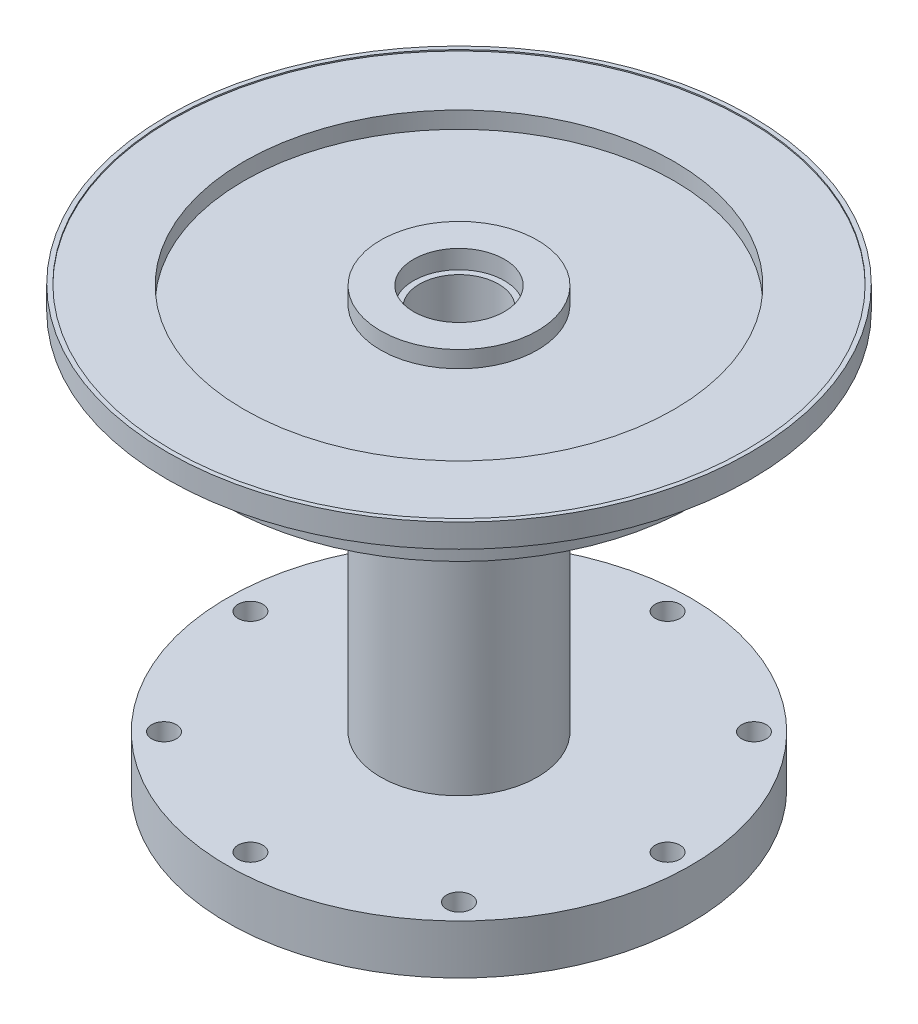
from build123d import *

# Parameters (mm, degrees)
SKETCH1_R           = 38.1
BOSS_EXTRUDE1_DEPTH = 4.826
SKETCH2_R           = 38.1
BOSS_EXTRUDE2_DEPTH = 3.302
BOSS_EXTRUDE2_DRAFT = -70
SKETCH3_R           = 47.172170439
BOSS_EXTRUDE3_DEPTH = 3.81
SKETCH4_R           = 46.472170439
CUT_EXTRUDE1_DEPTH  = 0.2
SKETCH6_R           = 34.772170439
SKETCH6_R_2         = 12.7
CUT_EXTRUDE2_DEPTH  = 2.7
SKETCH8_R           = 12.7
BOSS_EXTRUDE4_DEPTH = 50.8
SKETCH10_R          = 7.35
CUT_EXTRUDE5_DEPTH  = 3
SKETCH13_R          = 6.4
CUT_EXTRUDE9_DEPTH  = 92.577748235
SKETCH15_R          = 37.5
BOSS_EXTRUDE6_DEPTH = 8
CUT_EXTRUDE10_REACH = 99.233
SKETCH16_R          = 2
SKETCH16_R_2        = 5.35
SKETCH17_R          = 20.71
SKETCH17_R_2        = 19.21
CUT_EXTRUDE11_DEPTH = 3


with BuildPart() as part:
    # Sketch1 → Boss-Extrude1 (new body)
    with BuildSketch(Plane(origin=(0, 0, 0), x_dir=(1, 0, 0), z_dir=(0, 1, 0))):
        with Locations(Location((0, 0, 0), (0, 0, 270))):
            Circle(SKETCH1_R)
    extrude(amount=BOSS_EXTRUDE1_DEPTH)


with BuildPart() as boss_extrude2_tool:
    # Sketch2 → Boss-Extrude2 (with draft: the straight prism first)
    with BuildSketch(Plane(origin=(0, 4.826, 0), x_dir=(1, 0, 0), z_dir=(0, 1, 0))):
        with Locations(Location((0, 0, 0), (0, 0, 270))):
            Circle(SKETCH2_R)
    extrude(amount=BOSS_EXTRUDE2_DEPTH)
    # Boss-Extrude2: the draft: its side faces are tilted about the plane it starts from
    boss_extrude2_sides = [boss_extrude2_tool.faces().sort_by_distance(p)[0] for p in [
        (0, 6.477, -38.1),
    ]]
    draft(boss_extrude2_sides, Plane(origin=(0, 4.826, 0), x_dir=(1, 0, 0), z_dir=(0, 1, 0)), BOSS_EXTRUDE2_DRAFT)


with BuildPart() as part_1:
    add(part.part)

    # Boss-Extrude2: add boss_extrude2_tool
    add(boss_extrude2_tool.part)

    # Sketch3 → Boss-Extrude3 (add)
    with BuildSketch(Plane(origin=(0, 8.128, 0), x_dir=(1, 0, 0), z_dir=(0, 1, 0))):
        with Locations(Location((0, 0, 0), (0, 0, 90))):
            Circle(SKETCH3_R)
    extrude(amount=BOSS_EXTRUDE3_DEPTH)

    # Sketch4 → Cut-Extrude1 (cut)
    with BuildSketch(Plane(origin=(0, 11.938, 0), x_dir=(1, 0, 0), z_dir=(0, 1, 0))):
        with Locations(Location((0, 0, 0), (0, 0, 270))):
            Circle(SKETCH4_R)
    extrude(amount=-CUT_EXTRUDE1_DEPTH, mode=Mode.SUBTRACT)

    # Sketch6 → Cut-Extrude2 (cut)
    with BuildSketch(Plane(origin=(0, 11.738, 0), x_dir=(1, 0, 0), z_dir=(0, 1, 0))):
        with Locations(Location((0, 0, 0), (0, 0, 270))):
            Circle(SKETCH6_R)
        with Locations(Location((0, 0, 0), (0, 0, 270))):
            Circle(SKETCH6_R_2, mode=Mode.SUBTRACT)
    extrude(amount=-CUT_EXTRUDE2_DEPTH, mode=Mode.SUBTRACT)

    # Sketch8 → Boss-Extrude4 (add)
    with BuildSketch(Plane.XZ):
        with Locations(Location((0, 0, 0), (0, 0, 90))):
            Circle(SKETCH8_R)
    extrude(amount=BOSS_EXTRUDE4_DEPTH)

    # Sketch10 → Cut-Extrude5 (cut)
    with BuildSketch(Plane(origin=(0, 11.738, 0), x_dir=(1, 0, 0), z_dir=(0, 1, 0))):
        with Locations(Location((0, 0, 0), (0, 0, 270))):
            Circle(SKETCH10_R)
    extrude(amount=-CUT_EXTRUDE5_DEPTH, mode=Mode.SUBTRACT)

    # Sketch13 → Cut-Extrude9 (cut, through all)
    with BuildSketch(Plane(origin=(0, -50.8, 0), x_dir=(-1, 0, 0), z_dir=(0, -1, 0))):
        with Locations(Location((0, 0, 0), (0, 0, 90))):
            Circle(SKETCH13_R)
    extrude(amount=-CUT_EXTRUDE9_DEPTH, mode=Mode.SUBTRACT)

    # Sketch15 → Boss-Extrude6 (add)
    with BuildSketch(Plane.XZ.offset(50.8)):
        with Locations(Location((0, 0, 0), (0, 0, 270))):
            Circle(SKETCH15_R)
    extrude(amount=BOSS_EXTRUDE6_DEPTH)

    # Sketch16 → Cut-Extrude10 (cut, up to next)
    with BuildSketch(Plane.XZ.offset(58.8), mode=Mode.PRIVATE) as cut_extrude10_sk1:
        with Locations(Location((0, 33.75, 0), (0, 0, 270))):
            Circle(SKETCH16_R)
    cut_extrude10_tool1 = extrude(cut_extrude10_sk1.sketch, amount=-CUT_EXTRUDE10_REACH, mode=Mode.PRIVATE) & part_1.part
    # Sketch16 → Cut-Extrude10 (cut, up to next)
    with BuildSketch(Plane.XZ.offset(58.8), mode=Mode.PRIVATE) as cut_extrude10_sk2:
        with Locations(Location((23.864853865, 23.864853865, 0), (0, 0, 270))):
            Circle(SKETCH16_R)
    cut_extrude10_tool2 = extrude(cut_extrude10_sk2.sketch, amount=-CUT_EXTRUDE10_REACH, mode=Mode.PRIVATE) & part_1.part
    # Sketch16 → Cut-Extrude10 (cut, up to next)
    with BuildSketch(Plane.XZ.offset(58.8), mode=Mode.PRIVATE) as cut_extrude10_sk3:
        with Locations(Location((33.75, 0, 0), (0, 0, 270))):
            Circle(SKETCH16_R)
    cut_extrude10_tool3 = extrude(cut_extrude10_sk3.sketch, amount=-CUT_EXTRUDE10_REACH, mode=Mode.PRIVATE) & part_1.part
    # Sketch16 → Cut-Extrude10 (cut, up to next)
    with BuildSketch(Plane.XZ.offset(58.8), mode=Mode.PRIVATE) as cut_extrude10_sk4:
        with Locations(Location((23.864853865, -23.864853865, 0), (0, 0, 270))):
            Circle(SKETCH16_R)
    cut_extrude10_tool4 = extrude(cut_extrude10_sk4.sketch, amount=-CUT_EXTRUDE10_REACH, mode=Mode.PRIVATE) & part_1.part
    # Sketch16 → Cut-Extrude10 (cut, up to next)
    with BuildSketch(Plane.XZ.offset(58.8), mode=Mode.PRIVATE) as cut_extrude10_sk5:
        with Locations(Location((0, -33.75, 0), (0, 0, 270))):
            Circle(SKETCH16_R)
    cut_extrude10_tool5 = extrude(cut_extrude10_sk5.sketch, amount=-CUT_EXTRUDE10_REACH, mode=Mode.PRIVATE) & part_1.part
    # Sketch16 → Cut-Extrude10 (cut, up to next)
    with BuildSketch(Plane.XZ.offset(58.8), mode=Mode.PRIVATE) as cut_extrude10_sk6:
        with Locations(Location((-23.864853865, -23.864853865, 0), (0, 0, 270))):
            Circle(SKETCH16_R)
    cut_extrude10_tool6 = extrude(cut_extrude10_sk6.sketch, amount=-CUT_EXTRUDE10_REACH, mode=Mode.PRIVATE) & part_1.part
    # Sketch16 → Cut-Extrude10 (cut, up to next)
    with BuildSketch(Plane.XZ.offset(58.8), mode=Mode.PRIVATE) as cut_extrude10_sk7:
        with Locations(Location((-33.75, 0, 0), (0, 0, 270))):
            Circle(SKETCH16_R)
    cut_extrude10_tool7 = extrude(cut_extrude10_sk7.sketch, amount=-CUT_EXTRUDE10_REACH, mode=Mode.PRIVATE) & part_1.part
    # Sketch16 → Cut-Extrude10 (cut, up to next)
    with BuildSketch(Plane.XZ.offset(58.8), mode=Mode.PRIVATE) as cut_extrude10_sk8:
        with Locations(Location((-23.864853865, 23.864853865, 0), (0, 0, 270))):
            Circle(SKETCH16_R)
    cut_extrude10_tool8 = extrude(cut_extrude10_sk8.sketch, amount=-CUT_EXTRUDE10_REACH, mode=Mode.PRIVATE) & part_1.part
    # Sketch16 → Cut-Extrude10 (cut, up to next)
    with BuildSketch(Plane.XZ.offset(58.8), mode=Mode.PRIVATE) as cut_extrude10_sk9:
        with Locations(Location((0, 0, 0), (0, 0, 270))):
            Circle(SKETCH16_R_2)
    cut_extrude10_tool9 = extrude(cut_extrude10_sk9.sketch, amount=-CUT_EXTRUDE10_REACH, mode=Mode.PRIVATE) & part_1.part
    add(cut_extrude10_tool1.solids().sort_by_distance((0, -58.8, 33.75))[0], mode=Mode.SUBTRACT)
    add(cut_extrude10_tool2.solids().sort_by_distance((23.864854, -58.8, 23.864854))[0], mode=Mode.SUBTRACT)
    add(cut_extrude10_tool3.solids().sort_by_distance((33.75, -58.8, 0))[0], mode=Mode.SUBTRACT)
    add(cut_extrude10_tool4.solids().sort_by_distance((23.864854, -58.8, -23.864854))[0], mode=Mode.SUBTRACT)
    add(cut_extrude10_tool5.solids().sort_by_distance((0, -58.8, -33.75))[0], mode=Mode.SUBTRACT)
    add(cut_extrude10_tool6.solids().sort_by_distance((-23.864854, -58.8, -23.864854))[0], mode=Mode.SUBTRACT)
    add(cut_extrude10_tool7.solids().sort_by_distance((-33.75, -58.8, 0))[0], mode=Mode.SUBTRACT)
    add(cut_extrude10_tool8.solids().sort_by_distance((-23.864854, -58.8, 23.864854))[0], mode=Mode.SUBTRACT)
    add(cut_extrude10_tool9.solids().sort_by_distance((0, -58.8, 0))[0], mode=Mode.SUBTRACT)

    # Sketch17 → Cut-Extrude11 (cut)
    with BuildSketch(Plane.XZ.offset(58.8)):
        with Locations(Location((0, 0, 0), (0, 0, 270))):
            Circle(SKETCH17_R)
        with Locations(Location((0, 0, 0), (0, 0, 270))):
            Circle(SKETCH17_R_2, mode=Mode.SUBTRACT)
    extrude(amount=-CUT_EXTRUDE11_DEPTH, mode=Mode.SUBTRACT)


solid = part_1.part
